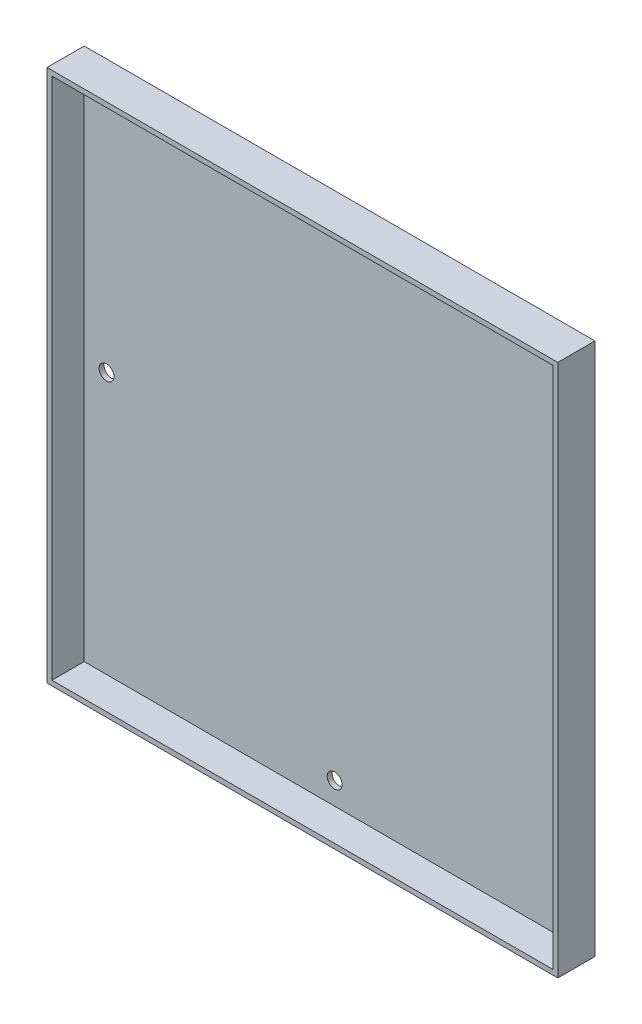
from build123d import *

# Parameters (mm, degrees)
SKETCH_1_W          = 206
SKETCH_1_H          = 215
EXTRUDE_1_DEPTH     = 15
SHELL_1_T           = -2
SKETCH_2_R          = 3
CUT_EXTRUDE_1_DEPTH = 15


with BuildPart() as part:
    # 草图1 → 凸台-拉伸1 (new body)
    with BuildSketch(Plane.XY):
        Rectangle(SKETCH_1_W, SKETCH_1_H)
    extrude(amount=EXTRUDE_1_DEPTH)

    # 抽壳1
    shell_1_openings = [part.faces().sort_by_distance(p)[0] for p in [
        (0, 0, 15),
    ]]
    offset(amount=SHELL_1_T, openings=shell_1_openings, kind=Kind.INTERSECTION)

    # 草图2 → 切除-拉伸1 (cut)
    with BuildSketch(Plane.XY.offset(2)):
        with Locations((-92, 0)):
            Circle(SKETCH_2_R)
        with Locations((0, 96.5)):
            Circle(SKETCH_2_R)
        with Locations((92, 0)):
            Circle(SKETCH_2_R)
        with Locations((0, -96.5)):
            Circle(SKETCH_2_R)
    extrude(amount=-CUT_EXTRUDE_1_DEPTH, mode=Mode.SUBTRACT)


solid = part.part
